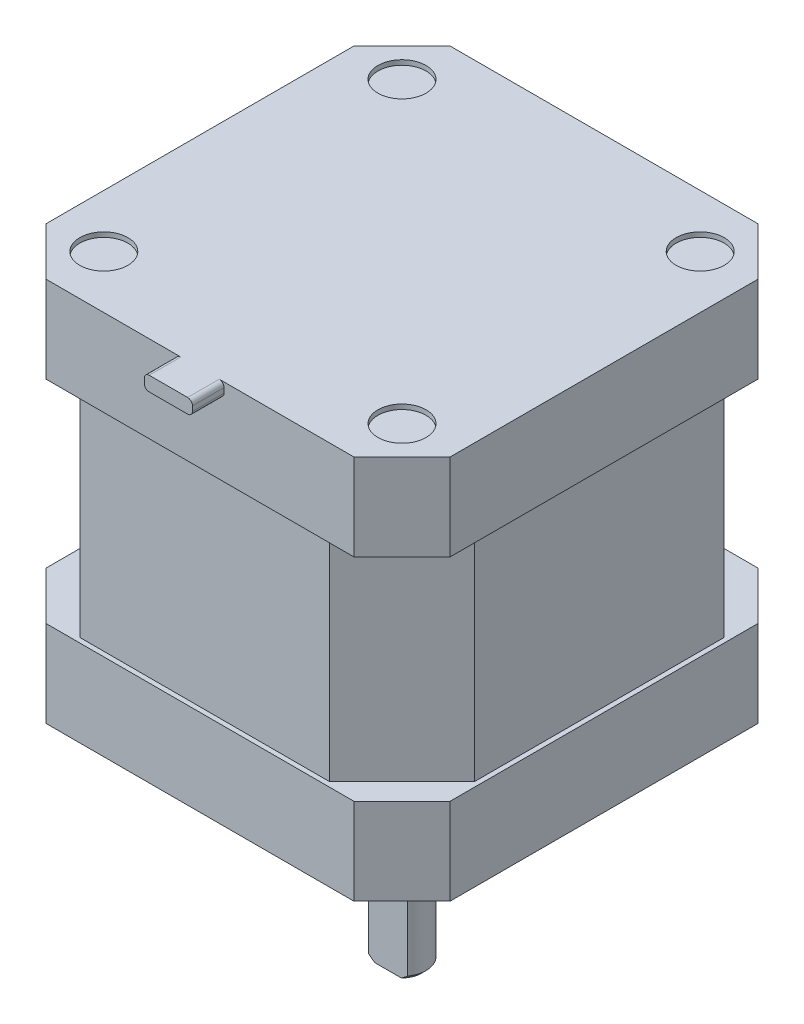
from build123d import *

# Parameters (mm, degrees)
ESQUISSE1_W                         = 42
ESQUISSE1_H                         = 9
BOSS_EXTRU_1_DEPTH                  = 0.5
BOSS_EXTRU_2_DEPTH                  = 41
ESQUISSE3_W                         = 42
ESQUISSE3_H                         = 9
BOSS_EXTRU_3_DEPTH                  = 0.5
ESQUISSE4_W                         = 42
ESQUISSE4_H                         = 42
BOSS_EXTRU_4_DEPTH                  = 9
ESQUISSE5_W                         = 5
ESQUISSE5_H                         = 1.5
BOSS_EXTRU_5_DEPTH                  = 3.2869072
ESQUISSE6_R                         = 11
BOSS_EXTRU_6_DEPTH                  = 2
DIAM_TRE_DU_PER_AGE_15_0_15_1_D     = 15
DIAM_TRE_DU_PER_AGE_15_0_15_1_DEPTH = 2
ESQUISSE9_R                         = 2.5
BOSS_EXTRU_7_DEPTH                  = 24
ENL_V_START                         = -20
ENL_V_MAT_EXTRU_1_DEPTH             = 20
DIAM_TRE_DU_PER_AGE_5_0_5_1_D       = 5
DIAM_TRE_DU_PER_AGE_5_0_5_1_DEPTH   = 0.5
D_GAGEMENT_M21_D                    = 2.459
D_GAGEMENT_M21_DEPTH                = 4.5
CHANFREIN1_SIZE                     = 7.535533906
CHANFREIN2_SIZE                     = 5
CHANFREIN3_SIZE                     = 0.5
CONG_1_R                            = 0.5


with BuildPart() as part:
    # Esquisse1 → Boss.-Extru.1 (new body)
    with BuildSketch(Plane.XY.offset(21)):
        with Locations((0, 4.5)):
            Rectangle(ESQUISSE1_W, ESQUISSE1_H)
    extrude(amount=-BOSS_EXTRU_1_DEPTH)

    # Esquisse2 → Boss.-Extru.2 (add)
    with BuildSketch(Plane(origin=(0, 0, 20.5), x_dir=(-1, 0, 0), z_dir=(0, 0, -1))):
        Polygon((-20.5, 9), (-20.5, 31), (20.5, 31), (20.5, 9), (21, 9), (21, 0), (-21, 0), (-21, 9), align=None)
    extrude(amount=BOSS_EXTRU_2_DEPTH)

    # Esquisse3 → Boss.-Extru.3 (add)
    with BuildSketch(Plane(origin=(0, 0, -20.5), x_dir=(-1, 0, 0), z_dir=(0, 0, -1))):
        with Locations((0, 4.5)):
            Rectangle(ESQUISSE3_W, ESQUISSE3_H)
    extrude(amount=BOSS_EXTRU_3_DEPTH)

    # Esquisse4 → Boss.-Extru.4 (add)
    with BuildSketch(Plane.XZ.offset(-31)):
        Rectangle(ESQUISSE4_W, ESQUISSE4_H)
    extrude(amount=-BOSS_EXTRU_4_DEPTH)

    # Esquisse5 → Boss.-Extru.5 (add)
    with BuildSketch(Plane.XY.offset(21)):
        with Locations((0, 39.25)):
            Rectangle(ESQUISSE5_W, ESQUISSE5_H)
    extrude(amount=BOSS_EXTRU_5_DEPTH)

    # Esquisse6 → Boss.-Extru.6 (add)
    with BuildSketch(Plane.XZ):
        with Locations(Location((0, 0, 0), (0, 0, 270))):
            Circle(ESQUISSE6_R)
    extrude(amount=BOSS_EXTRU_6_DEPTH)

    # Diamètre du perçage Ø15.0 (15)1
    with Locations(Plane(origin=(0, -2, 0), x_dir=(-1, 0, 0), z_dir=(0, -1, 0))):
        with Locations((0, 0)):
            Hole(DIAM_TRE_DU_PER_AGE_15_0_15_1_D / 2, depth=DIAM_TRE_DU_PER_AGE_15_0_15_1_DEPTH)

    # Esquisse9 → Boss.-Extru.7 (add)
    with BuildSketch(Plane.XZ):
        with Locations(Location((0, 0, 0), (0, 0, 90))):
            Circle(ESQUISSE9_R)
    extrude(amount=BOSS_EXTRU_7_DEPTH)

    # Esquisse10 → Enlèv. mat.-Extru.1 (cut)
    with BuildSketch(Plane.XZ.offset(24).offset(ENL_V_START)):
        with BuildLine():
            Line((-2.038647634, 1.447036912), (2.038647634, 1.447036912))
            ThreePointArc((2.038647634, 1.447036912), (0, 2.5), (-2.038647634, 1.447036912))
        make_face()
    extrude(amount=ENL_V_MAT_EXTRU_1_DEPTH, mode=Mode.SUBTRACT)

    # Diamètre du perçage Ø5.0 (5)1
    with Locations(Plane(origin=(0, 40, 0), x_dir=(1, 0, 0), z_dir=(0, 1, 0))):
        with Locations((15.5, -15.5), (-15.5, -15.5), (-15.5, 15.5), (15.5, 15.5)):
            Hole(DIAM_TRE_DU_PER_AGE_5_0_5_1_D / 2, depth=DIAM_TRE_DU_PER_AGE_5_0_5_1_DEPTH)

    # Dégagement M21
    with Locations(Plane(origin=(0, 0, 0), x_dir=(-1, 0, 0), z_dir=(0, -1, 0))):
        with Locations((15.5, -15.5), (-15.5, -15.5), (-15.5, 15.5), (15.5, 15.5)):
            Hole(D_GAGEMENT_M21_D / 2, depth=D_GAGEMENT_M21_DEPTH)

    # Chanfrein1
    chanfrein1_edges = [part.edges().sort_by_distance(p)[0] for p in [
        (-20.5, 20, 20.5),
        (20.5, 20, 20.5),
        (-20.5, 20, -20.5),
        (20.5, 20, -20.5),
    ]]
    chamfer(chanfrein1_edges, length=CHANFREIN1_SIZE)

    # Chanfrein2
    chanfrein2_edges = [part.edges().sort_by_distance(p)[0] for p in [
        (21, 4.5, -21),
        (-21, 4.5, -21),
        (-21, 35.5, 21),
        (21, 35.5, 21),
        (21, 35.5, -21),
        (-21, 35.5, -21),
        (-21, 4.5, 21),
        (21, 4.5, 21),
    ]]
    chamfer(chanfrein2_edges, length=CHANFREIN2_SIZE)

    # Chanfrein3
    chanfrein3_edges = [part.edges().sort_by_distance(p)[0] for p in [
        (0, -24, -2.5),
    ]]
    chamfer(chanfrein3_edges, length=CHANFREIN3_SIZE)

    # Congé1
    cong_1_edges = [part.edges().sort_by_distance(p)[0] for p in [
        (-2.5, 40, 22.6434536),
        (-2.5, 38.5, 22.6434536),
        (2.5, 38.5, 22.6434536),
        (2.5, 40, 22.6434536),
    ]]
    fillet(cong_1_edges, radius=CONG_1_R)


solid = part.part
